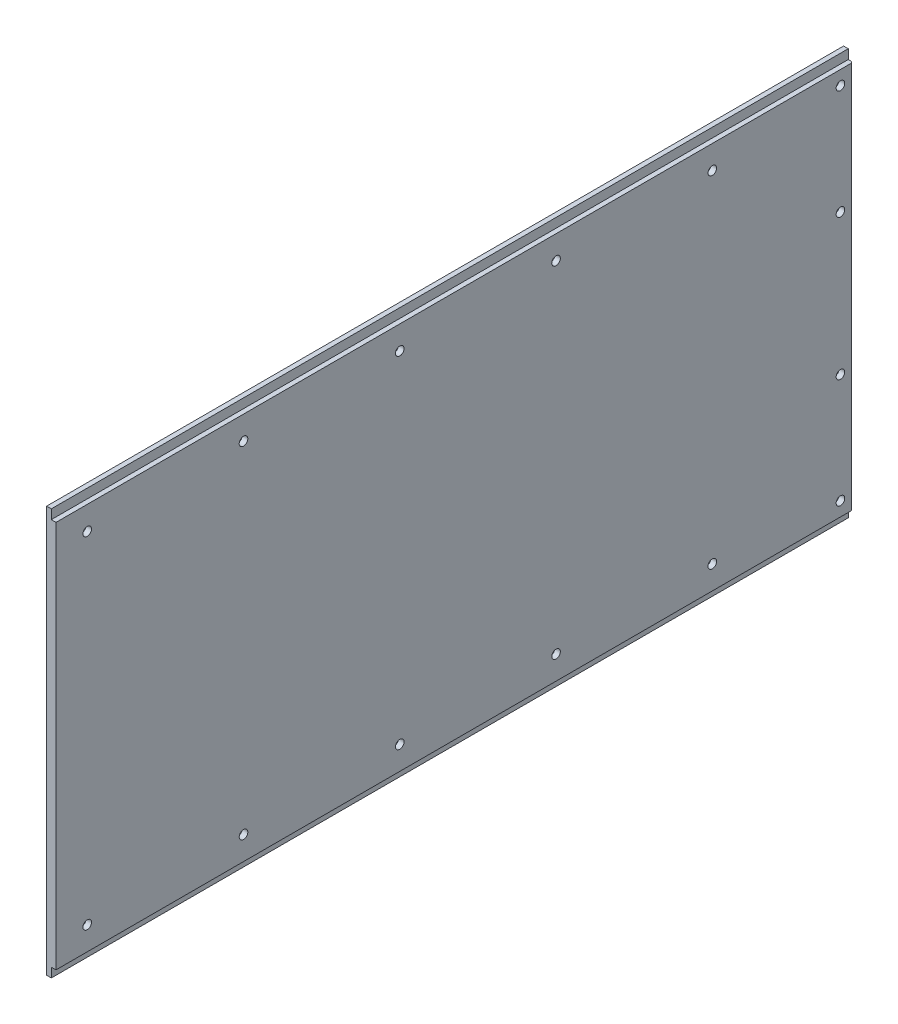
from build123d import *

# Parameters (mm, degrees)
SKETCH1_W                                            = 510
SKETCH1_H                                            = 260
BOSS_EXTRUDE1_DEPTH                                  = 6
SKIZZE2_W                                            = 3
SKIZZE2_H                                            = 6
SCHNITT_LINEAR_AUSTRAGEN1_DEPTH                      = 527.34209408
FORMSENKUNG_FUR_M5_LINSENSENKSCHRAUBE_MI_D           = 5.5
FORMSENKUNG_FUR_M5_LINSENSENKSCHRAUBE_MI_CSINK_D     = 10.4
FORMSENKUNG_FUR_M5_LINSENSENKSCHRAUBE_MI_CSINK_ANGLE = 90
CHAMFER1_SIZE                                        = 1
CSK_FOR_M5_COUNTERSUNK_RAISED_HEAD_SCREW_D           = 5.5
CSK_FOR_M5_COUNTERSUNK_RAISED_HEAD_SCREW_CSINK_D     = 10.4
CSK_FOR_M5_COUNTERSUNK_RAISED_HEAD_SCREW_CSINK_ANGLE = 90
LPATTERN1_COUNT                                      = 5
LPATTERN1_PITCH                                      = 100
MIRROR1_COPY_1_D                                     = 5.5
MIRROR1_COPY_1_CSINK_D                               = 10.4
MIRROR1_COPY_1_CSINK_ANGLE                           = 90
MIRROR1_COPY_2_D                                     = 5.5
MIRROR1_COPY_2_CSINK_D                               = 10.4
MIRROR1_COPY_2_CSINK_ANGLE                           = 90
MIRROR1_COPY_3_D                                     = 5.5
MIRROR1_COPY_3_CSINK_D                               = 10.4
MIRROR1_COPY_3_CSINK_ANGLE                           = 90
MIRROR1_COPY_4_D                                     = 5.5
MIRROR1_COPY_4_CSINK_D                               = 10.4
MIRROR1_COPY_4_CSINK_ANGLE                           = 90


with BuildPart() as part:
    # Sketch1 → Boss-Extrude1 (new body)
    with BuildSketch(Plane(origin=(0, 0, 0), x_dir=(0, 0, -1), z_dir=(1, 0, 0))):
        Rectangle(SKETCH1_W, SKETCH1_H)
    extrude(amount=BOSS_EXTRUDE1_DEPTH)

    # Skizze2 → Schnitt-Linear austragen1 (cut, through all)
    with BuildSketch(Plane.XY.offset(255)):
        with Locations((4.5, 127)):
            Rectangle(SKIZZE2_W, SKIZZE2_H)
        with Locations((4.5, -127)):
            Rectangle(SKIZZE2_W, SKIZZE2_H)
    extrude(amount=-SCHNITT_LINEAR_AUSTRAGEN1_DEPTH, mode=Mode.SUBTRACT)

    # Formsenkung fur M5 Linsensenkschraube mit Schlitz1 (through all)
    with Locations(Plane.ZY):
        with Locations((-247, 115), (-247, 45)):
            formsenkung_fur_m5_linsensenkschraube_mi = CounterSinkHole(FORMSENKUNG_FUR_M5_LINSENSENKSCHRAUBE_MI_D / 2, FORMSENKUNG_FUR_M5_LINSENSENKSCHRAUBE_MI_CSINK_D / 2, counter_sink_angle=FORMSENKUNG_FUR_M5_LINSENSENKSCHRAUBE_MI_CSINK_ANGLE)

    # Spiegeln1: Formsenkung fur M5 Linsensenkschraube mit Schlitz1 across plane
    add(formsenkung_fur_m5_linsensenkschraube_mi.mirror(Plane.ZX), mode=Mode.SUBTRACT)

    # Chamfer1
    chamfer1_edges = [part.edges().sort_by_distance(p)[0] for p in [
        (6, 0, -255),
    ]]
    chamfer(chamfer1_edges, length=CHAMFER1_SIZE)

    # CSK for M5 Countersunk Raised Head Screw1 (through all)
    with Locations(Plane.ZY):
        with Locations((235, -109)):
            csk_for_m5_countersunk_raised_head_screw = CounterSinkHole(CSK_FOR_M5_COUNTERSUNK_RAISED_HEAD_SCREW_D / 2, CSK_FOR_M5_COUNTERSUNK_RAISED_HEAD_SCREW_CSINK_D / 2, counter_sink_angle=CSK_FOR_M5_COUNTERSUNK_RAISED_HEAD_SCREW_CSINK_ANGLE)

    # LPattern1: CSK for M5 Countersunk Raised Head Screw1 ×5
    with Locations(*[(0, 0, -i * LPATTERN1_PITCH) for i in range(1, LPATTERN1_COUNT)]):
        add(csk_for_m5_countersunk_raised_head_screw, mode=Mode.SUBTRACT)

    # Mirror1: CSK for M5 Countersunk Raised Head Screw1 across plane
    add(csk_for_m5_countersunk_raised_head_screw.mirror(Plane.ZX), mode=Mode.SUBTRACT)

    # Mirror1 copy 1 (through all)
    with Locations(Plane(origin=(0, 0, -100), x_dir=(0, 0, 1), z_dir=(-1, 0, 0))):
        with Locations((235, 109)):
            CounterSinkHole(MIRROR1_COPY_1_D / 2, MIRROR1_COPY_1_CSINK_D / 2, counter_sink_angle=MIRROR1_COPY_1_CSINK_ANGLE)

    # Mirror1 copy 2 (through all)
    with Locations(Plane(origin=(0, 0, -200), x_dir=(0, 0, 1), z_dir=(-1, 0, 0))):
        with Locations((235, 109)):
            CounterSinkHole(MIRROR1_COPY_2_D / 2, MIRROR1_COPY_2_CSINK_D / 2, counter_sink_angle=MIRROR1_COPY_2_CSINK_ANGLE)

    # Mirror1 copy 3 (through all)
    with Locations(Plane(origin=(0, 0, -300), x_dir=(0, 0, 1), z_dir=(-1, 0, 0))):
        with Locations((235, 109)):
            CounterSinkHole(MIRROR1_COPY_3_D / 2, MIRROR1_COPY_3_CSINK_D / 2, counter_sink_angle=MIRROR1_COPY_3_CSINK_ANGLE)

    # Mirror1 copy 4 (through all)
    with Locations(Plane(origin=(0, 0, -400), x_dir=(0, 0, 1), z_dir=(-1, 0, 0))):
        with Locations((235, 109)):
            CounterSinkHole(MIRROR1_COPY_4_D / 2, MIRROR1_COPY_4_CSINK_D / 2, counter_sink_angle=MIRROR1_COPY_4_CSINK_ANGLE)


solid = part.part
